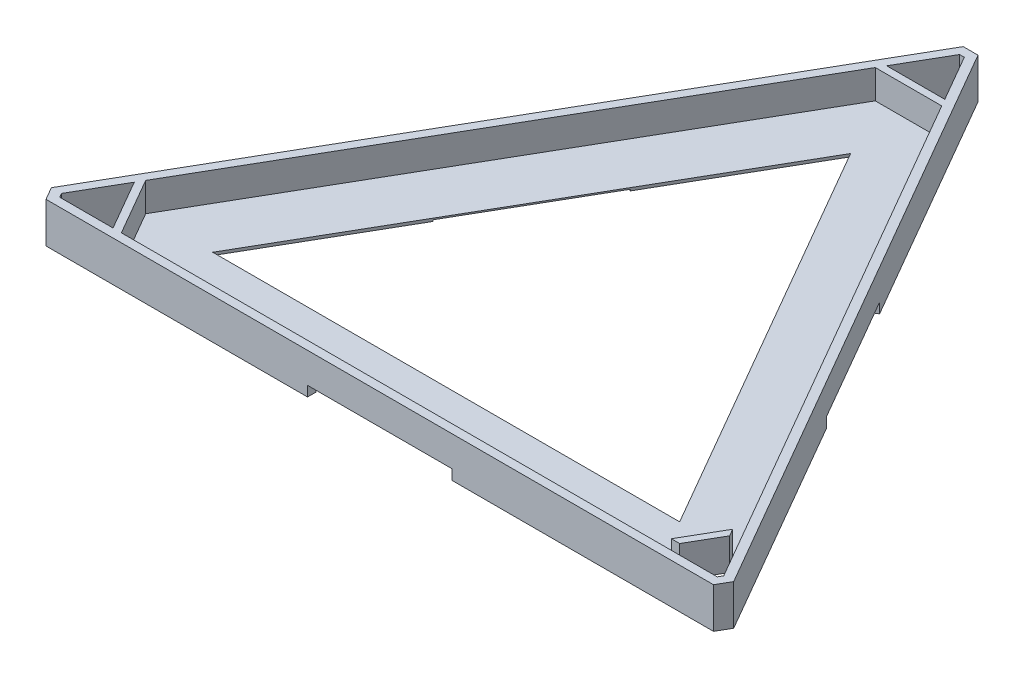
from build123d import *

# Parameters (mm, degrees)
BOSS_EXTRUDE1_DEPTH      = 1
BOSS_EXTRUDE2_DEPTH      = 11
BOSS_EXTRUDE3_DEPTH      = 5
BOSS_EXTRUDE3_DEPTH_BACK = 3
SKETCH3_W                = 50
SKETCH3_H                = 7
CUT_EXTRUDE3_DEPTH       = 25
SKETCH5_W                = 50
SKETCH5_H                = 7
CUT_EXTRUDE4_DEPTH       = 25
SKETCH6_W                = 50
SKETCH6_H                = 7
CUT_EXTRUDE5_DEPTH       = 25


with BuildPart() as part:
    # Sketch1 → Boss-Extrude1 (new body)
    with BuildSketch(Plane(origin=(0, 0, 0), x_dir=(1, 0, 0), z_dir=(0, 1, 0))):
        Polygon((243.304219773, -116.484791866), (254.809280576, -136.408896139), (442.602090749, -136.409305398), (444.621046679, -132.925433223), (441.749040748, -132.925433223), (449.516726723, -119.471406457), (450.964695297, -121.978953122), (452.699916621, -118.984688017), (358.778179035, 43.666038066), (335.767496284, 43.666038066), align=None)
        Polygon((428.113670919, -116.417164681), (266.439108268, -116.428009241), (347.273609729, 23.609230825), align=None, mode=Mode.SUBTRACT)
    extrude(amount=BOSS_EXTRUDE1_DEPTH)

    # Sketch1<9> → Boss-Extrude2 (add)
    # profile 1 of 2: a face of its own
    with BuildSketch(Plane(origin=(0, 0, 0), x_dir=(1, 0, 0), z_dir=(0, 1, 0))):
        Polygon((229.159432547, -134.984249184), (231.716666588, -139.412373829), (462.829865412, -139.412373829), (465.38624875, -134.984588004), (349.829542096, 65.165499075), (344.716133219, 65.165499075), align=None)
        Polygon((251.922647988, -136.4093054), (233.446303399, -136.408896139), (232.623553959, -134.984217358), (241.860901688, -118.984688019), align=None, mode=Mode.SUBTRACT)
        Polygon((442.602090749, -136.409305398), (254.809280576, -136.408896139), (243.304219773, -116.484791866), (335.767496284, 43.666038066), (358.778179035, 43.666038066), (461.938967957, -134.984588004), (461.116393748, -136.409305398), align=None, mode=Mode.SUBTRACT)
        Polygon((348.096628302, 62.164013367), (357.334800991, 46.166038067), (337.210874326, 46.166038067), (346.44844193, 62.165948237), align=None, mode=Mode.SUBTRACT)
    # profile 2 of 2: a face of its own
    with BuildSketch(Plane(origin=(0, 0, 0), x_dir=(1, 0, 0), z_dir=(0, 1, 0))):
        Polygon((441.749040748, -132.925433223), (444.621046679, -132.925433223), (450.964695297, -121.978953122), (449.516726723, -119.471406457), align=None)
    extrude(amount=BOSS_EXTRUDE2_DEPTH)

    # Sketch1<10> → Boss-Extrude3 (add, two sides: drawn at the far end of the back side and taken through both)
    with BuildSketch(Plane(origin=(0, 0, 0), x_dir=(1, 0, 0), z_dir=(0, 1, 0)).offset(-BOSS_EXTRUDE3_DEPTH_BACK)):
        Polygon((229.159432547, -134.984249184), (231.716666588, -139.412373829), (462.829865412, -139.412373829), (465.38624875, -134.984588004), (349.829542096, 65.165499075), (344.716133219, 65.165499075), align=None)
        Polygon((251.922647988, -136.4093054), (233.446303399, -136.408896139), (232.623553959, -134.984217358), (241.860901688, -118.984688019), align=None, mode=Mode.SUBTRACT)
        Polygon((442.602090749, -136.409305398), (254.809280576, -136.408896139), (243.304219773, -116.484791866), (335.767496284, 43.666038066), (358.778179035, 43.666038066), (452.699916621, -118.984688017), (461.938967957, -134.984588004), (461.116393748, -136.409305398), align=None, mode=Mode.SUBTRACT)
        Polygon((348.096628302, 62.164013367), (357.334800991, 46.166038067), (337.210874326, 46.166038067), (346.44844193, 62.165948237), align=None, mode=Mode.SUBTRACT)
    extrude(amount=BOSS_EXTRUDE3_DEPTH + BOSS_EXTRUDE3_DEPTH_BACK)

    # Sketch3 → Cut-Extrude3 (cut)
    with BuildSketch(Plane(origin=(290.589645397, 0, -167.772009994), x_dir=(-0.49999999999998745, 0, -0.8660254037844459), z_dir=(0.8660254037844459, 0, -0.49999999999998745))):
        with Locations((-236.592990632, -3)):
            Rectangle(SKETCH3_W, SKETCH3_H)
    extrude(amount=-CUT_EXTRUDE3_DEPTH, mode=Mode.SUBTRACT)

    # Sketch5 → Cut-Extrude4 (cut)
    with BuildSketch(Plane.XY.offset(139.412373829)):
        with Locations((347.273266, -3)):
            Rectangle(SKETCH5_W, SKETCH5_H)
    extrude(amount=-CUT_EXTRUDE4_DEPTH, mode=Mode.SUBTRACT)

    # Sketch6 → Cut-Extrude5 (cut)
    with BuildSketch(Plane(origin=(230.319375797, 0, 132.975171838), x_dir=(-0.5000006154012504, 0, 0.8660250484820695), z_dir=(-0.8660250484820695, 0, -0.5000006154012504))):
        with Locations((-113.2366748, -3)):
            Rectangle(SKETCH6_W, SKETCH6_H)
    extrude(amount=-CUT_EXTRUDE5_DEPTH, mode=Mode.SUBTRACT)


solid = part.part
